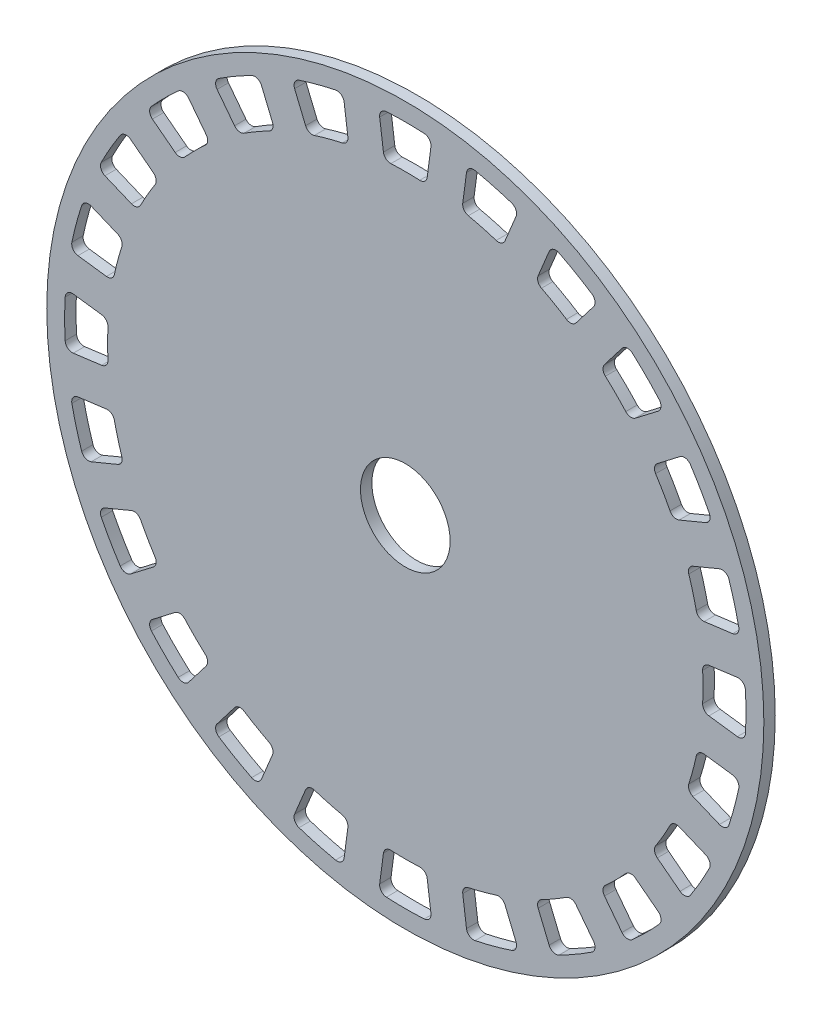
from build123d import *

# Parameters (mm, degrees)
SKETCH1_R                             = 100
SKETCH1_R_2                           = 12.5
PLATE_EXTRUDE_DEPTH                   = 3.175
COIL_MOUNTING_CUT_DEPTH               = 142.456992139
COIL_MOUNTING_FILLET_R                = 2
CIRPATTERN1_COUNT                     = 24
COIL_MOUNTING_FILLET_OF_CIRPATTERN1_R = 2


with BuildPart() as part:
    # Sketch1 → Plate Extrude (new body)
    with BuildSketch(Plane.XY):
        Circle(SKETCH1_R)
        Circle(SKETCH1_R_2, mode=Mode.SUBTRACT)
    extrude(amount=PLATE_EXTRUDE_DEPTH)

    # Sketch2 → Coil Mounting Cut (cut, through all)
    with BuildSketch(Plane.XY.offset(3.175)):
        with BuildLine():
            Line((5.860123663, 82.818546294), (7.42643797, 94.71588463))
            ThreePointArc((7.42643797, 94.71588463), (0, 95.006582836), (-7.42643797, 94.71588463))
            Line((-7.42643797, 94.71588463), (-5.860123663, 82.818546294))
            ThreePointArc((-5.860123663, 82.818546294), (0, 83.025614479), (5.860123663, 82.818546294))
        make_face()
    coil_mounting_cut = extrude(amount=-COIL_MOUNTING_CUT_DEPTH, mode=Mode.SUBTRACT)

    # Coil Mounting Fillet
    coil_mounting_fillet_edges = [part.edges().sort_by_distance(p)[0] for p in [
        (-7.42643797, 94.71588463, 1.5875),
        (7.42643797, 94.71588463, 1.5875),
        (5.860123663, 82.818546294, 1.5875),
        (-5.860123663, 82.818546294, 1.5875),
    ]]
    fillet(coil_mounting_fillet_edges, radius=COIL_MOUNTING_FILLET_R)

    # CirPattern1: Coil Mounting Cut ×24 about axis
    cirpattern1_axis = Axis((0, 0, 0), (0, 0, 1))
    for i in range(1, CIRPATTERN1_COUNT):
        add(coil_mounting_cut.rotate(cirpattern1_axis, i * 360 / CIRPATTERN1_COUNT), mode=Mode.SUBTRACT)

    # Coil Mounting Fillet of CirPattern1
    coil_mounting_fillet_of_cirpattern1_edges = [part.edges().sort_by_distance(p)[0] for p in [
        (-31.687663049, 89.56641554, 1.5875),
        (-17.340886584, 93.410622708, 1.5875),
        (-15.774572277, 81.513284372, 1.5875),
        (-27.09546186, 78.47986115, 1.5875),
        (-53.789426257, 78.313143247, 1.5875),
        (-40.926458374, 85.739581217, 1.5875),
        (-36.334257185, 74.653026827, 1.5875),
        (-46.484289109, 68.792903163, 1.5875),
        (-72.225528957, 61.72295966, 1.5875),
        (-61.72295966, 72.225528957, 1.5875),
        (-54.417822512, 62.705288873, 1.5875),
        (-62.705288873, 54.417822512, 1.5875),
        (-85.739581217, 40.926458374, 1.5875),
        (-78.313143247, 53.789426257, 1.5875),
        (-68.792903163, 46.484289109, 1.5875),
        (-74.653026827, 36.334257185, 1.5875),
        (-93.410622708, 17.340886584, 1.5875),
        (-89.56641554, 31.687663049, 1.5875),
        (-78.47986115, 27.09546186, 1.5875),
        (-81.513284372, 15.774572277, 1.5875),
        (-94.71588463, -7.42643797, 1.5875),
        (-94.71588463, 7.42643797, 1.5875),
        (-82.818546294, 5.860123663, 1.5875),
        (-82.818546294, -5.860123663, 1.5875),
        (-89.56641554, -31.687663049, 1.5875),
        (-93.410622708, -17.340886584, 1.5875),
        (-81.513284372, -15.774572277, 1.5875),
        (-78.47986115, -27.09546186, 1.5875),
        (-78.313143247, -53.789426257, 1.5875),
        (-85.739581217, -40.926458374, 1.5875),
        (-74.653026827, -36.334257185, 1.5875),
        (-68.792903163, -46.484289109, 1.5875),
        (-61.72295966, -72.225528957, 1.5875),
        (-72.225528957, -61.72295966, 1.5875),
        (-62.705288873, -54.417822512, 1.5875),
        (-54.417822512, -62.705288873, 1.5875),
        (-40.926458374, -85.739581217, 1.5875),
        (-53.789426257, -78.313143247, 1.5875),
        (-46.484289109, -68.792903163, 1.5875),
        (-36.334257185, -74.653026827, 1.5875),
        (-17.340886584, -93.410622708, 1.5875),
        (-31.687663049, -89.56641554, 1.5875),
        (-27.09546186, -78.47986115, 1.5875),
        (-15.774572277, -81.513284372, 1.5875),
        (7.42643797, -94.71588463, 1.5875),
        (-7.42643797, -94.71588463, 1.5875),
        (-5.860123663, -82.818546294, 1.5875),
        (5.860123663, -82.818546294, 1.5875),
        (31.687663049, -89.56641554, 1.5875),
        (17.340886584, -93.410622708, 1.5875),
        (15.774572277, -81.513284372, 1.5875),
        (27.09546186, -78.47986115, 1.5875),
        (53.789426257, -78.313143247, 1.5875),
        (40.926458374, -85.739581217, 1.5875),
        (36.334257185, -74.653026827, 1.5875),
        (46.484289109, -68.792903163, 1.5875),
        (72.225528957, -61.72295966, 1.5875),
        (61.72295966, -72.225528957, 1.5875),
        (54.417822512, -62.705288873, 1.5875),
        (62.705288873, -54.417822512, 1.5875),
        (85.739581217, -40.926458374, 1.5875),
        (78.313143247, -53.789426257, 1.5875),
        (68.792903163, -46.484289109, 1.5875),
        (74.653026827, -36.334257185, 1.5875),
        (93.410622708, -17.340886584, 1.5875),
        (89.56641554, -31.687663049, 1.5875),
        (78.47986115, -27.09546186, 1.5875),
        (81.513284372, -15.774572277, 1.5875),
        (94.71588463, 7.42643797, 1.5875),
        (94.71588463, -7.42643797, 1.5875),
        (82.818546294, -5.860123663, 1.5875),
        (82.818546294, 5.860123663, 1.5875),
        (89.56641554, 31.687663049, 1.5875),
        (93.410622708, 17.340886584, 1.5875),
        (81.513284372, 15.774572277, 1.5875),
        (78.47986115, 27.09546186, 1.5875),
        (78.313143247, 53.789426257, 1.5875),
        (85.739581217, 40.926458374, 1.5875),
        (74.653026827, 36.334257185, 1.5875),
        (68.792903163, 46.484289109, 1.5875),
        (61.72295966, 72.225528957, 1.5875),
        (72.225528957, 61.72295966, 1.5875),
        (62.705288873, 54.417822512, 1.5875),
        (54.417822512, 62.705288873, 1.5875),
        (40.926458374, 85.739581217, 1.5875),
        (53.789426257, 78.313143247, 1.5875),
        (46.484289109, 68.792903163, 1.5875),
        (36.334257185, 74.653026827, 1.5875),
        (17.340886584, 93.410622708, 1.5875),
        (31.687663049, 89.56641554, 1.5875),
        (27.09546186, 78.47986115, 1.5875),
        (15.774572277, 81.513284372, 1.5875),
    ]]
    fillet(coil_mounting_fillet_of_cirpattern1_edges, radius=COIL_MOUNTING_FILLET_OF_CIRPATTERN1_R)


solid = part.part
